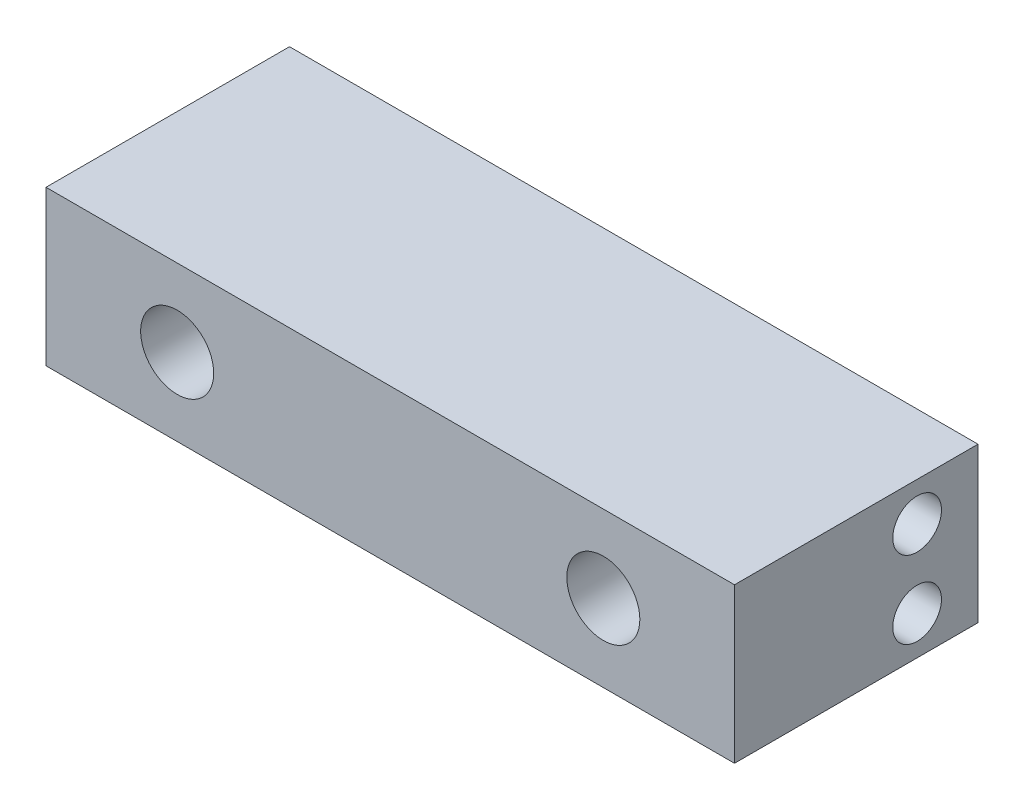
from build123d import *

# Parameters (mm, degrees)
SKETCH1_W           = 56.55
SKETCH1_H           = 12.7
BOSS_EXTRUDE1_DEPTH = 20
CUT_EXTRUDE1_DEPTH  = 12
SKETCH3_R           = 2
CUT_EXTRUDE2_DEPTH  = 14


with BuildPart() as part:
    # Sketch1 → Boss-Extrude1 (new body)
    with BuildSketch(Plane.XY):
        Rectangle(SKETCH1_W, SKETCH1_H)
    extrude(amount=BOSS_EXTRUDE1_DEPTH)

    # Sketch2 → Cut-Extrude1 (cut)
    with BuildSketch(Plane.XY.offset(20)):
        with BuildLine():
            Line((-20.5, 0), (-17.5, 0))
            Line((-17.5, 0), (-14.5, 0))
            ThreePointArc((-14.5, 0), (-17.5, 3), (-20.5, 0))
        make_face()
        with BuildLine():
            Line((-14.5, 0), (-17.5, 0))
            Line((-17.5, 0), (-20.5, 0))
            ThreePointArc((-20.5, 0), (-17.5, -3), (-14.5, 0))
        make_face()
        with BuildLine():
            ThreePointArc((20.5, 0), (17.5, 3), (14.5, 0))
            Line((14.5, 0), (17.5, 0))
            Line((17.5, 0), (20.5, 0))
        make_face()
        with BuildLine():
            Line((17.5, 0), (14.5, 0))
            ThreePointArc((14.5, 0), (17.5, -3), (20.5, 0))
            Line((20.5, 0), (17.5, 0))
        make_face()
    extrude(amount=-CUT_EXTRUDE1_DEPTH, mode=Mode.SUBTRACT)

    # Sketch3 → Cut-Extrude2 (cut)
    with BuildSketch(Plane.ZY.offset(28.275)):
        with Locations(Location((5, 3.175, 0), (0, 0, 270))):
            Circle(SKETCH3_R)
        with Locations(Location((5, -3.175, 0), (0, 0, 270))):
            Circle(SKETCH3_R)
    cut_extrude2 = extrude(amount=-CUT_EXTRUDE2_DEPTH, mode=Mode.SUBTRACT)

    # Mirror1: Cut-Extrude2 across plane
    add(cut_extrude2.mirror(Plane(origin=(0, 0, 0), x_dir=(0, 0, 1), z_dir=(1, 0, 0))), mode=Mode.SUBTRACT)


solid = part.part
